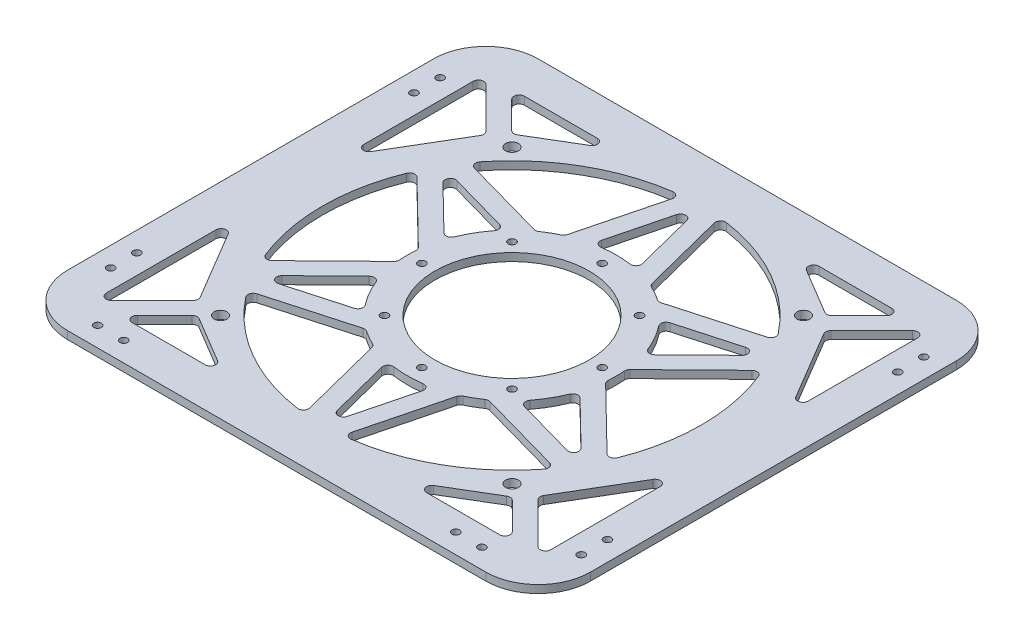
from build123d import *
from build123d.topology import SkipClean

# Parameters (mm, degrees)
SKETCH_1_W          = 200
SKETCH_1_H          = 180
SKETCH_1_R          = 2.45
EXTRUDE_1_DEPTH     = 3
SKETCH_2_R          = 1.45
SKETCH_2_R_2        = 29.5
CUT_EXTRUDE_1_DEPTH = 135.56968455
CUT_EXTRUDE_4_DEPTH = 135.56968455
CUT_EXTRUDE_6_DEPTH = 135.56968455
FILLET_2_R          = 20
FILLET_3_R          = 2
SKETCH_4_R          = 1.45
CUT_EXTRUDE_5_DEPTH = 135.56968455


with BuildPart() as part:
    # 草图1 → 凸台-拉伸1 (new body)
    with BuildSketch(Plane(origin=(0, 0, 0), x_dir=(1, 0, 0), z_dir=(0, 1, 0))):
        Rectangle(SKETCH_1_W, SKETCH_1_H)
        with Locations(Location((55.741227561, 55.741227561, 0), (0, 0, 270))):
            Circle(SKETCH_1_R, mode=Mode.SUBTRACT)
        with Locations(Location((55.741227561, -55.741227561, 0), (0, 0, 270))):
            Circle(SKETCH_1_R, mode=Mode.SUBTRACT)
        with Locations(Location((-55.741227561, -55.741227561, 0), (0, 0, 270))):
            Circle(SKETCH_1_R, mode=Mode.SUBTRACT)
        with Locations(Location((-55.741227561, 55.741227561, 0), (0, 0, 270))):
            Circle(SKETCH_1_R, mode=Mode.SUBTRACT)
    extrude(amount=EXTRUDE_1_DEPTH)

    # 草图2 → 切除-拉伸1 (cut, through all)
    with BuildSketch(Plane(origin=(0, 3, 0), x_dir=(1, 0, 0), z_dir=(0, 1, 0))):
        with Locations(Location((0, 34.5, 0), (0, 0, 270))):
            Circle(SKETCH_2_R)
        with Locations(Location((24.395183951, 24.395183951, 0), (0, 0, 270))):
            Circle(SKETCH_2_R)
        with Locations(Location((34.5, 0, 0), (0, 0, 270))):
            Circle(SKETCH_2_R)
        with Locations(Location((24.395183951, -24.395183951, 0), (0, 0, 270))):
            Circle(SKETCH_2_R)
        with Locations(Location((0, -34.5, 0), (0, 0, 270))):
            Circle(SKETCH_2_R)
        with Locations(Location((-24.395183951, -24.395183951, 0), (0, 0, 270))):
            Circle(SKETCH_2_R)
        with Locations(Location((-34.5, 0, 0), (0, 0, 270))):
            Circle(SKETCH_2_R)
        with Locations(Location((-24.395183951, 24.395183951, 0), (0, 0, 270))):
            Circle(SKETCH_2_R)
        with Locations(Location((0, 0, 0), (0, 0, 270))):
            Circle(SKETCH_2_R_2)
    extrude(amount=-CUT_EXTRUDE_1_DEPTH, mode=Mode.SUBTRACT)

    # 草图3 → 切除-拉伸4 (cut, through all)
    with BuildSketch(Plane(origin=(0, 3, 0), x_dir=(1, 0, 0), z_dir=(0, 1, 0))):
        with BuildLine():
            Line((-32.730683921, 64.691207517), (-16.435647127, 36.467375879))
            Line((-16.435647127, 36.467375879), (-7.319768209, 72.129543138))
            ThreePointArc((-7.319768209, 72.129543138), (-20.367667715, 69.58022788), (-32.730683921, 64.691207517))
        make_face()
        with BuildLine():
            Line((0, 72.5), (8.54352027, 39.076953072))
            ThreePointArc((8.54352027, 39.076953072), (0, 40), (-8.54352027, 39.076953072))
            Line((-8.54352027, 39.076953072), (0, 72.5))
        make_face()
        with BuildLine():
            Line((16.435647127, 36.467375879), (7.319768209, 72.129543138))
            ThreePointArc((7.319768209, 72.129543138), (20.367667715, 69.58022788), (32.730683921, 64.691207517))
            Line((32.730683921, 64.691207517), (16.435647127, 36.467375879))
        make_face()
        Polygon((-85, 75), (-64.895742754, 54.895742754), (-85, 21), align=None)
        with BuildLine():
            Line((-39.658887151, 60.691207517), (-23.363850357, 32.467375879))
            Line((-23.363850357, 32.467375879), (-58.806132617, 42.403876788))
            ThreePointArc((-58.806132617, 42.403876788), (-50.074411088, 52.429031597), (-39.658887151, 60.691207517))
        make_face()
        with BuildLine():
            Line((-72.389571072, 4), (-39.799497484, 4))
            Line((-39.799497484, 4), (-66.125900826, 29.72566635))
            ThreePointArc((-66.125900826, 29.72566635), (-70.442078803, 17.151196283), (-72.389571072, 4))
        make_face()
        with BuildLine():
            Line((-62.786841774, 36.25), (-38.113394198, 12.139570944))
            ThreePointArc((-38.113394198, 12.139570944), (-34.641016151, 20), (-29.569873928, 26.937382128))
            Line((-29.569873928, 26.937382128), (-62.786841774, 36.25))
        make_face()
        with BuildLine():
            Line((39.658887151, 60.691207517), (23.363850357, 32.467375879))
            Line((23.363850357, 32.467375879), (58.806132617, 42.403876788))
            ThreePointArc((58.806132617, 42.403876788), (50.074411088, 52.429031597), (39.658887151, 60.691207517))
        make_face()
        with BuildLine():
            Line((62.786841774, 36.25), (38.113394198, 12.139570944))
            ThreePointArc((38.113394198, 12.139570944), (34.641016151, 20), (29.569873928, 26.937382128))
            Line((29.569873928, 26.937382128), (62.786841774, 36.25))
        make_face()
        with BuildLine():
            Line((39.799497484, 4), (66.125900826, 29.72566635))
            ThreePointArc((66.125900826, 29.72566635), (70.442078803, 17.151196283), (72.389571072, 4))
            Line((72.389571072, 4), (39.799497484, 4))
        make_face()
        with BuildLine():
            Line((72.389571072, -4), (39.799497484, -4))
            Line((39.799497484, -4), (66.125900826, -29.72566635))
            ThreePointArc((66.125900826, -29.72566635), (70.442078803, -17.151196283), (72.389571072, -4))
        make_face()
        with BuildLine():
            Line((62.786841774, -36.25), (29.569873928, -26.937382128))
            ThreePointArc((29.569873928, -26.937382128), (34.641016151, -20), (38.113394198, -12.139570944))
            Line((38.113394198, -12.139570944), (62.786841774, -36.25))
        make_face()
        with BuildLine():
            Line((23.363850357, -32.467375879), (58.806132617, -42.403876788))
            ThreePointArc((58.806132617, -42.403876788), (50.074411088, -52.429031597), (39.658887151, -60.691207517))
            Line((39.658887151, -60.691207517), (23.363850357, -32.467375879))
        make_face()
        with BuildLine():
            Line((32.730683921, -64.691207517), (16.435647127, -36.467375879))
            Line((16.435647127, -36.467375879), (7.319768209, -72.129543138))
            ThreePointArc((7.319768209, -72.129543138), (20.367667715, -69.58022788), (32.730683921, -64.691207517))
        make_face()
        with BuildLine():
            Line((0, -72.5), (-8.54352027, -39.076953072))
            ThreePointArc((-8.54352027, -39.076953072), (0, -40), (8.54352027, -39.076953072))
            Line((8.54352027, -39.076953072), (0, -72.5))
        make_face()
        with BuildLine():
            Line((-16.435647127, -36.467375879), (-7.319768209, -72.129543138))
            ThreePointArc((-7.319768209, -72.129543138), (-20.367667715, -69.58022788), (-32.730683921, -64.691207517))
            Line((-32.730683921, -64.691207517), (-16.435647127, -36.467375879))
        make_face()
        with BuildLine():
            Line((-39.658887151, -60.691207517), (-23.363850357, -32.467375879))
            Line((-23.363850357, -32.467375879), (-58.806132617, -42.403876788))
            ThreePointArc((-58.806132617, -42.403876788), (-50.074411088, -52.429031597), (-39.658887151, -60.691207517))
        make_face()
        with BuildLine():
            Line((-62.786841774, -36.25), (-38.113394198, -12.139570944))
            ThreePointArc((-38.113394198, -12.139570944), (-34.641016151, -20), (-29.569873928, -26.937382128))
            Line((-29.569873928, -26.937382128), (-62.786841774, -36.25))
        make_face()
        with BuildLine():
            Line((-39.799497484, -4), (-66.125900826, -29.72566635))
            ThreePointArc((-66.125900826, -29.72566635), (-70.442078803, -17.151196283), (-72.389571072, -4))
            Line((-72.389571072, -4), (-39.799497484, -4))
        make_face()
        Polygon((-75.100505063, 75), (-60.154307925, 60.053802861), (-35.100505063, 75), align=None)
        Polygon((64.895742754, 54.895742754), (85, 21), (85, 75), align=None)
        Polygon((60.154307925, 60.053802861), (35.100505063, 75), (75.100505063, 75), align=None)
        Polygon((85, -75), (64.895742754, -54.895742754), (85, -21), align=None)
        Polygon((75.100505063, -75), (60.154307925, -60.053802861), (35.100505063, -75), align=None)
        Polygon((-60.154307925, -60.053802861), (-35.100505063, -75), (-75.100505063, -75), align=None)
        Polygon((-64.895742754, -54.895742754), (-85, -21), (-85, -75), align=None)
    extrude(amount=-CUT_EXTRUDE_4_DEPTH, mode=Mode.SUBTRACT)

    # 草图5 → 切除-拉伸6 (cut, through all)
    with SkipClean():  # the faces are left unmerged after this step: merging them gives an invalid solid
        with BuildSketch(Plane(origin=(0, 3, 0), x_dir=(1, 0, 0), z_dir=(0, 1, 0))):
            with BuildLine():
                Line((-72.389571072, 4), (-39.799497484, 4))
                ThreePointArc((-39.799497484, 4), (-40, 0), (-39.799497484, -4))
                Line((-39.799497484, -4), (-72.389571072, -4))
                ThreePointArc((-72.389571072, -4), (-72.5, 0), (-72.389571072, 4))
            make_face()
            with BuildLine():
                Line((-39.658887151, 60.691207517), (-23.363850357, 32.467375879))
                ThreePointArc((-23.363850357, 32.467375879), (-20, 34.641016151), (-16.435647127, 36.467375879))
                Line((-16.435647127, 36.467375879), (-32.730683921, 64.691207517))
                ThreePointArc((-32.730683921, 64.691207517), (-36.25, 62.786841774), (-39.658887151, 60.691207517))
            make_face()
            with BuildLine():
                Line((32.730683921, 64.691207517), (16.435647127, 36.467375879))
                ThreePointArc((16.435647127, 36.467375879), (20, 34.641016151), (23.363850357, 32.467375879))
                Line((23.363850357, 32.467375879), (39.658887151, 60.691207517))
                ThreePointArc((39.658887151, 60.691207517), (36.25, 62.786841774), (32.730683921, 64.691207517))
            make_face()
            with BuildLine():
                Line((72.389571072, 4), (39.799497484, 4))
                ThreePointArc((39.799497484, 4), (40, 0), (39.799497484, -4))
                Line((39.799497484, -4), (72.389571072, -4))
                ThreePointArc((72.389571072, -4), (72.5, 0), (72.389571072, 4))
            make_face()
            with BuildLine():
                Line((39.658887151, -60.691207517), (23.363850357, -32.467375879))
                ThreePointArc((23.363850357, -32.467375879), (20, -34.641016151), (16.435647127, -36.467375879))
                Line((16.435647127, -36.467375879), (32.730683921, -64.691207517))
                ThreePointArc((32.730683921, -64.691207517), (36.25, -62.786841774), (39.658887151, -60.691207517))
            make_face()
            with BuildLine():
                Line((-32.730683921, -64.691207517), (-16.435647127, -36.467375879))
                ThreePointArc((-16.435647127, -36.467375879), (-20, -34.641016151), (-23.363850357, -32.467375879))
                Line((-23.363850357, -32.467375879), (-39.658887151, -60.691207517))
                ThreePointArc((-39.658887151, -60.691207517), (-36.25, -62.786841774), (-32.730683921, -64.691207517))
            make_face()
        extrude(amount=-CUT_EXTRUDE_6_DEPTH, mode=Mode.SUBTRACT)

    # 圆角2
    fillet_2_edges = [part.edges().sort_by_distance(p)[0] for p in [
        (100, 1.5, 90),
        (-100, 1.5, 90),
        (-100, 1.5, -90),
        (100, 1.5, -90),
    ]]
    fillet(fillet_2_edges, radius=FILLET_2_R)

    # 圆角3
    fillet_3_edges = [part.edges().sort_by_distance(p)[0] for p in [
        (-62.786841774, 1.5, -36.25),
        (-29.569873928, 1.5, -26.937382128),
        (-38.113394198, 1.5, -12.139570944),
        (-66.125900826, 1.5, -29.72566635),
        (-39.799497484, 1.5, -4),
        (7.319768209, 1.5, -72.129543138),
        (16.435647127, 1.5, -36.467375879),
        (-7.319768209, 1.5, -72.129543138),
        (-16.435647127, 1.5, -36.467375879),
        (58.806132617, 1.5, -42.403876788),
        (23.363850357, 1.5, -32.467375879),
        (29.569873928, 1.5, -26.937382128),
        (62.786841774, 1.5, -36.25),
        (38.113394198, 1.5, -12.139570944),
        (66.125900826, 1.5, -29.72566635),
        (39.799497484, 1.5, -4),
        (-8.54352027, 1.5, -39.076953072),
        (0, 1.5, -72.5),
        (8.54352027, 1.5, -39.076953072),
        (-85, 1.5, 75),
        (-85, 1.5, 21),
        (-64.895742754, 1.5, 54.895742754),
        (85, 1.5, -75),
        (85, 1.5, -21),
        (64.895742754, 1.5, -54.895742754),
        (85, 1.5, 21),
        (85, 1.5, 75),
        (64.895742754, 1.5, 54.895742754),
        (-64.895742754, 1.5, -54.895742754),
        (-85, 1.5, -21),
        (-85, 1.5, -75),
        (-58.806132617, 1.5, -42.403876788),
        (-23.363850357, 1.5, -32.467375879),
        (75.100505063, 1.5, -75),
        (60.154307925, 1.5, -60.053802861),
        (35.100505063, 1.5, -75),
        (75.100505063, 1.5, 75),
        (35.100505063, 1.5, 75),
        (60.154307925, 1.5, 60.053802861),
        (-75.100505063, 1.5, 75),
        (-60.154307925, 1.5, 60.053802861),
        (-35.100505063, 1.5, 75),
        (-29.569873928, 1.5, 26.937382128),
        (-62.786841774, 1.5, 36.25),
        (-38.113394198, 1.5, 12.139570944),
        (-7.319768209, 1.5, 72.129543138),
        (-16.435647127, 1.5, 36.467375879),
        (38.113394198, 1.5, 12.139570944),
        (62.786841774, 1.5, 36.25),
        (29.569873928, 1.5, 26.937382128),
        (66.125900826, 1.5, 29.72566635),
        (39.799497484, 1.5, 4),
        (58.806132617, 1.5, 42.403876788),
        (23.363850357, 1.5, 32.467375879),
        (8.54352027, 1.5, 39.076953072),
        (0, 1.5, 72.5),
        (-8.54352027, 1.5, 39.076953072),
        (7.319768209, 1.5, 72.129543138),
        (16.435647127, 1.5, 36.467375879),
        (-66.125900826, 1.5, 29.72566635),
        (-39.799497484, 1.5, 4),
        (-58.806132617, 1.5, 42.403876788),
        (-23.363850357, 1.5, 32.467375879),
        (-75.100505063, 1.5, -75),
        (-35.100505063, 1.5, -75),
        (-60.154307925, 1.5, -60.053802861),
    ]]
    fillet(fillet_3_edges, radius=FILLET_3_R)

    # 草图4 → 切除-拉伸5 (cut, through all)
    with BuildSketch(Plane(origin=(0, 3, 0), x_dir=(1, 0, 0), z_dir=(0, 1, 0))):
        with Locations(Location((-92.5, -61, 0), (0, 0, 270))):
            Circle(SKETCH_4_R)
        with Locations(Location((-92.5, -51, 0), (0, 0, 270))):
            Circle(SKETCH_4_R)
        with Locations(Location((-76, -82.5, 0), (0, 0, 270))):
            Circle(SKETCH_4_R)
        with Locations(Location((-66, -82.5, 0), (0, 0, 270))):
            Circle(SKETCH_4_R)
        with Locations(Location((61, -82.5, 0), (0, 0, 270))):
            Circle(SKETCH_4_R)
        with Locations(Location((71, -82.5, 0), (0, 0, 270))):
            Circle(SKETCH_4_R)
        with Locations(Location((92.5, -66, 0), (0, 0, 270))):
            Circle(SKETCH_4_R)
        with Locations(Location((92.5, -56, 0), (0, 0, 270))):
            Circle(SKETCH_4_R)
        with Locations(Location((-92.5, 55, 0), (0, 0, 270))):
            Circle(SKETCH_4_R)
        with Locations(Location((-92.5, 65, 0), (0, 0, 270))):
            Circle(SKETCH_4_R)
        with Locations(Location((92.5, 65, 0), (0, 0, 270))):
            Circle(SKETCH_4_R)
        with Locations(Location((92.5, 55, 0), (0, 0, 270))):
            Circle(SKETCH_4_R)
    extrude(amount=-CUT_EXTRUDE_5_DEPTH, mode=Mode.SUBTRACT)


solid = part.part
